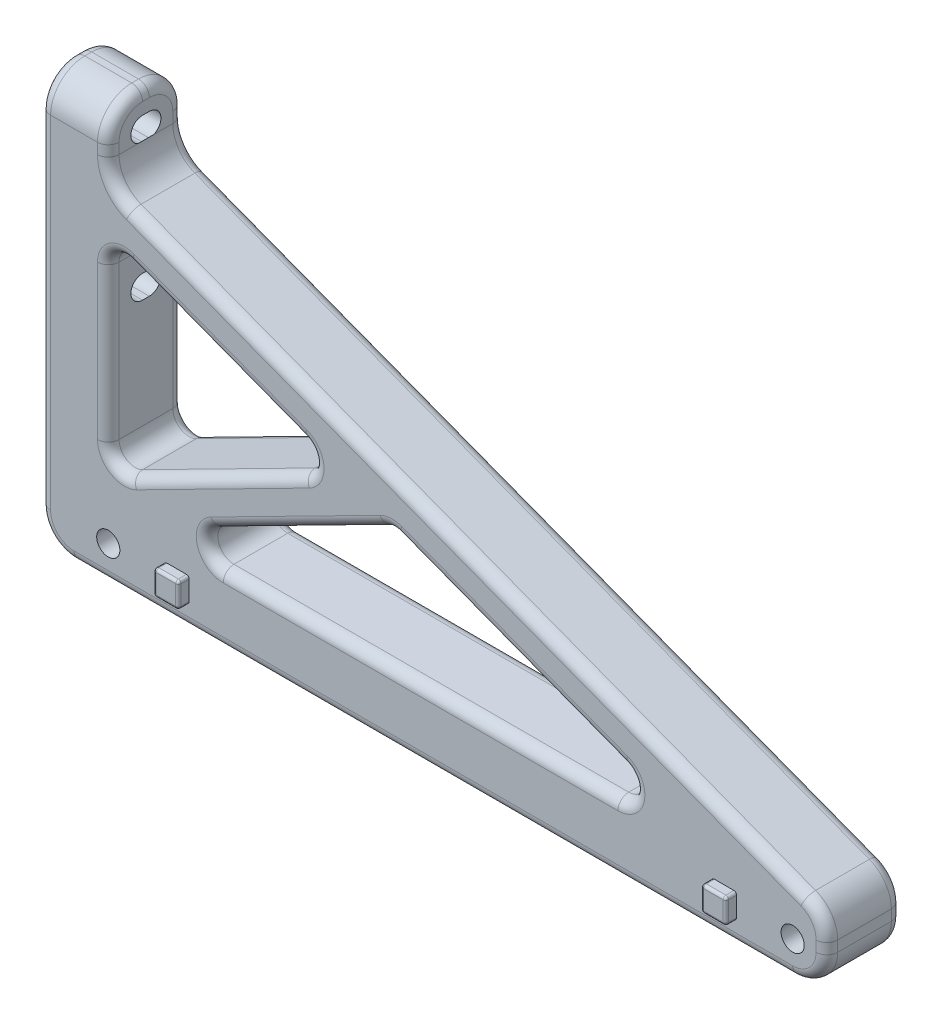
from build123d import *

# Parameters (mm, degrees)
SKETCH1_R           = 2.15
SKETCH1_W           = 12.7
SKETCH1_H           = 12.7
BOSS_EXTRUDE1_DEPTH = 13.97
FILLET1_R           = 3
FILLET2_R           = 6.35
CUT_EXTRUDE1_DEPTH  = 152.183351927
FILLET3_R           = 2
SKETCH3_W           = 4.6228
SKETCH3_H           = 4.6228
BOSS_EXTRUDE2_DEPTH = 2
FILLET4_R           = 0.508


with BuildPart() as part:
    # Sketch1 → Boss-Extrude1 (new body)
    # profile 1 of 5: a face of its own
    with BuildSketch(Plane.XY):
        Polygon((0, 57.15), (-12.7, 57.15), (-12.7, -6.35), (133.35, -6.35), (133.35, 6.35), align=None)
        Circle(SKETCH1_R, mode=Mode.SUBTRACT)
        Polygon((0, 10.838020995), (0, 48.589159979), (42.42795548, 32.42612932), (47.471976934, 30.504597338), (52.515998389, 28.583065355), (110.877794946, 6.35), (8.820483578, 6.35), (0, 6.35), align=None, mode=Mode.SUBTRACT)
        with Locations((127, 0)):
            Circle(SKETCH1_R, mode=Mode.SUBTRACT)
    # profile 2 of 5: a face of its own
    with BuildSketch(Plane.XY):
        Polygon((133.35, 6.35), (0, 57.15), (-12.7, 57.15), (-12.7, -6.35), (133.35, -6.35), align=None)
        with Locations((127, 0)):
            Circle(SKETCH1_R, mode=Mode.SUBTRACT)
        Circle(SKETCH1_R, mode=Mode.SUBTRACT)
        Polygon((110.877794946, 6.35), (0, 48.589159979), (0, 6.35), align=None, mode=Mode.SUBTRACT)
    # profile 3 of 5: a face of its own
    with BuildSketch(Plane.XY):
        Polygon((42.42795548, 32.42612932), (0, 10.838020995), (0, 6.35), (47.471976934, 30.504597338), align=None)
    # profile 4 of 5: a face of its own
    with BuildSketch(Plane.XY):
        Polygon((47.471976934, 30.504597338), (0, 6.35), (8.820483578, 6.35), (52.515998389, 28.583065355), align=None)
    # profile 5 of 5: a face of its own
    with BuildSketch(Plane.XY):
        with Locations((-6.35, 63.5)):
            Rectangle(SKETCH1_W, SKETCH1_H)
    extrude(amount=BOSS_EXTRUDE1_DEPTH)

    # Fillet1
    fillet1_edges = [part.edges().sort_by_distance(p)[0] for p in [
        (52.515998389, 28.583065355, 6.985),
        (8.820483578, 6.35, 6.985),
        (110.877794946, 6.35, 6.985),
        (0, 48.589159979, 6.985),
        (0, 10.838020995, 6.985),
        (42.42795548, 32.42612932, 6.985),
    ]]
    fillet(fillet1_edges, radius=FILLET1_R)

    # Fillet2
    fillet2_edges = [part.edges().sort_by_distance(p)[0] for p in [
        (-6.35, 69.85, 0),
        (133.35, 6.35, 6.985),
        (133.35, -6.35, 6.985),
        (-12.7, -6.35, 6.985),
        (0, 57.15, 6.985),
        (-6.35, 69.85, 13.97),
    ]]
    fillet(fillet2_edges, radius=FILLET2_R)

    # Sketch2 → Cut-Extrude1 (cut, through all)
    with BuildSketch(Plane(origin=(0, 0, 0), x_dir=(0, 0, -1), z_dir=(1, 0, 0))):
        with BuildLine():
            Line((-7.62, 65.65), (-6.35, 65.65))
            ThreePointArc((-6.35, 65.65), (-4.2, 63.5), (-6.35, 61.35))
            Line((-6.35, 61.35), (-7.62, 61.35))
            ThreePointArc((-7.62, 61.35), (-9.77, 63.5), (-7.62, 65.65))
        make_face()
        with BuildLine():
            Line((-7.62, 35.95), (-6.35, 35.95))
            ThreePointArc((-6.35, 35.95), (-4.2, 38.1), (-6.35, 40.25))
            Line((-6.35, 40.25), (-7.62, 40.25))
            ThreePointArc((-7.62, 40.25), (-9.77, 38.1), (-7.62, 35.95))
        make_face()
    extrude(amount=-CUT_EXTRUDE1_DEPTH, mode=Mode.SUBTRACT)

    # Fillet3
    fillet3_edges = [part.edges().sort_by_distance(p)[0] for p in [
        (-12.7, 31.75, 13.97),
        (-12.7, 67.990128061, 12.110128061),
        (-12.7, 67.990128061, 1.859871939),
        (66.675, 31.75, 13.97),
        (60.325, -6.35, 13.97),
        (133.35, 0.986940426, 13.97),
        (132.22862896, 5.577204208, 13.97),
        (-10.840128061, -4.490128061, 13.97),
        (131.490128061, -4.490128061, 13.97),
        (1.12137104, 57.922795792, 0),
        (1.12137104, 57.922795792, 13.97),
        (57.953790951, 6.35, 0),
        (57.953790951, 6.35, 13.97),
        (74.701339099, 20.131506989, 0),
        (74.701339099, 20.131506989, 13.97),
        (35.65095639, 20.001828068, 0),
        (35.65095639, 20.001828068, 13.97),
        (0, 29.983239316, 0),
        (0, 29.983239316, 13.97),
        (20.378926173, 21.207185872, 0),
        (20.378926173, 21.207185872, 13.97),
        (20.086442529, 40.937181873, 0),
        (20.086442529, 40.937181873, 13.97),
        (97.526174762, 8.80704034, 0),
        (97.526174762, 8.80704034, 13.97),
        (52.531016852, 28.301819395, 0),
        (52.531016852, 28.301819395, 13.97),
        (18.414557487, 8.650483328, 0),
        (18.414557487, 8.650483328, 13.97),
        (1.431785869, 13.173010707, 0),
        (1.431785869, 13.173010707, 13.97),
        (38.032644918, 32.191420837, 0),
        (38.032644918, 32.191420837, 13.97),
        (1.297642509, 46.706206235, 0),
        (1.297642509, 46.706206235, 13.97),
        (66.675, 31.75, 0),
        (133.35, 0.986940426, 0),
        (60.325, -6.35, 0),
        (-12.7, 31.75, 0),
        (0, 62.513059574, 0),
        (132.22862896, 5.577204208, 0),
        (-10.840128061, -4.490128061, 0),
        (131.490128061, -4.490128061, 0),
        (0, 69.85, 6.985),
        (0, 62.513059574, 13.97),
        (0, 67.990128061, 12.110128061),
        (0, 67.990128061, 1.859871939),
        (-12.7, 69.85, 6.985),
    ]]
    fillet(fillet3_edges, radius=FILLET3_R)

    # Sketch3 → Boss-Extrude2 (add)
    with BuildSketch(Plane.XY.offset(13.97)):
        with Locations((12.7, 0)):
            Rectangle(SKETCH3_W, SKETCH3_H)
        with Locations((114.3, 0)):
            Rectangle(SKETCH3_W, SKETCH3_H)
    extrude(amount=BOSS_EXTRUDE2_DEPTH)

    # Fillet4
    fillet4_edges = [part.edges().sort_by_distance(p)[0] for p in [
        (15.0114, -2.3114, 14.97),
        (15.0114, 2.3114, 14.97),
        (10.3886, 2.3114, 14.97),
        (10.3886, -2.3114, 14.97),
        (15.0114, 0, 15.97),
        (12.7, 2.3114, 15.97),
        (10.3886, 0, 15.97),
        (12.7, -2.3114, 15.97),
        (116.6114, -2.3114, 14.97),
        (116.6114, 2.3114, 14.97),
        (111.9886, 2.3114, 14.97),
        (111.9886, -2.3114, 14.97),
        (116.6114, 0, 15.97),
        (114.3, 2.3114, 15.97),
        (111.9886, 0, 15.97),
        (114.3, -2.3114, 15.97),
    ]]
    fillet(fillet4_edges, radius=FILLET4_R)


solid = part.part
